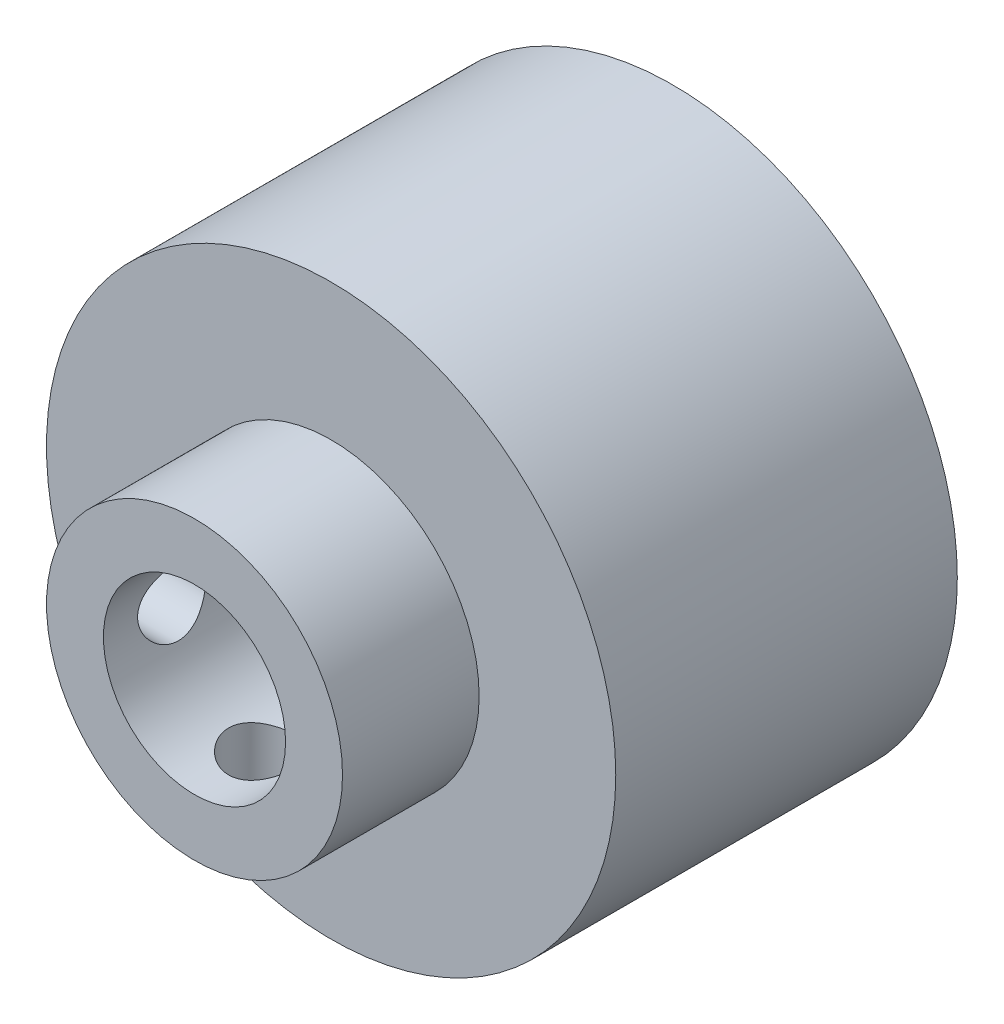
from build123d import *

# Parameters (mm, degrees)
SKETCH1_R           = 12.5
BOSS_EXTRUDE1_DEPTH = 15
SKETCH2_R           = 6.5
BOSS_EXTRUDE2_DEPTH = 6
SKETCH3_R           = 4
CUT_EXTRUDE1_DEPTH  = 28.449954463
SKETCH4_R           = 1.5
CUT_EXTRUDE2_DEPTH  = 28.449954463
SKETCH5_R           = 1.5
CUT_EXTRUDE3_DEPTH  = 28.449954539


with BuildPart() as part:
    # Sketch1 → Boss-Extrude1 (new body)
    with BuildSketch(Plane.XY):
        Circle(SKETCH1_R)
    extrude(amount=BOSS_EXTRUDE1_DEPTH)

    # Sketch2 → Boss-Extrude2 (add)
    with BuildSketch(Plane.XY.offset(15)):
        Circle(SKETCH2_R)
    extrude(amount=BOSS_EXTRUDE2_DEPTH)

    # Sketch3 → Cut-Extrude1 (cut, through all)
    with BuildSketch(Plane.XY.offset(21)):
        Circle(SKETCH3_R)
    extrude(amount=-CUT_EXTRUDE1_DEPTH, mode=Mode.SUBTRACT)

    # Sketch4 → Cut-Extrude2 (cut, through all)
    with BuildSketch(Plane(origin=(0, 0, 0), x_dir=(1, 0, 0), z_dir=(0, 1, 0))):
        with Locations(Location((0, -18, 0), (0, 0, 270))):
            Circle(SKETCH4_R)
    extrude(amount=-CUT_EXTRUDE2_DEPTH, mode=Mode.SUBTRACT)

    # Sketch5 → Cut-Extrude3 (cut, through all)
    with BuildSketch(Plane(origin=(0, 0, 0), x_dir=(0, 0, -1), z_dir=(1, 0, 0))):
        with Locations((-18, 0)):
            Circle(SKETCH5_R)
    extrude(amount=-CUT_EXTRUDE3_DEPTH, mode=Mode.SUBTRACT)


solid = part.part
